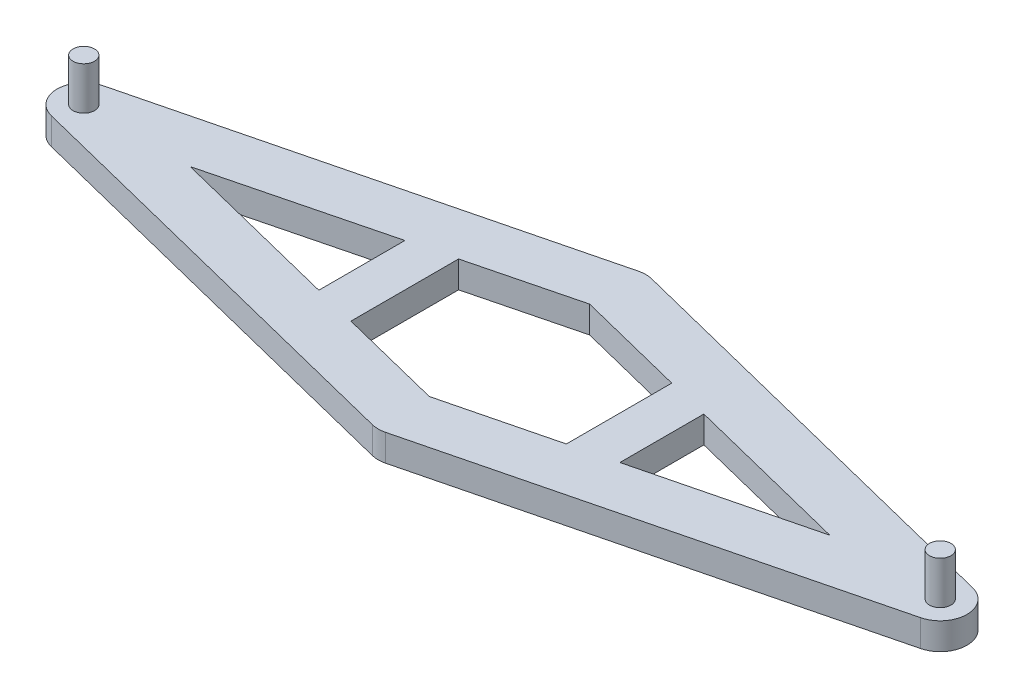
from build123d import *

# Parameters (mm, degrees)
BOSS_EXTRUDE1_DEPTH = 3.175
SKETCH5_R           = 1.27
BOSS_EXTRUDE2_DEPTH = 5.08
SKETCH6_R           = 1.27
BOSS_EXTRUDE3_DEPTH = 5.08
SKETCH10_W          = 5.08
SKETCH10_H          = 16.51
BOSS_EXTRUDE6_DEPTH = 3.175


with BuildPart() as part:
    # Sketch2 → Boss-Extrude1 (new body)
    with BuildSketch(Plane(origin=(0, 0, 0), x_dir=(1, 0, 0), z_dir=(0, 1, 0))):
        with BuildLine():
            Line((-51.57005061, 3.080202438), (-0.770050609, 15.780202438))
            ThreePointArc((-0.770050609, 15.780202438), (0, 15.875), (0.770050609, 15.780202438))
            Line((0.770050609, 15.780202438), (51.57005061, 3.080202438))
            ThreePointArc((51.57005061, 3.080202438), (53.975, 0), (51.57005061, -3.080202438))
            Line((51.57005061, -3.080202438), (0.770050609, -15.780202438))
            ThreePointArc((0.770050609, -15.780202438), (0, -15.875), (-0.770050609, -15.780202438))
            Line((-0.770050609, -15.780202438), (-51.57005061, -3.080202438))
            ThreePointArc((-51.57005061, -3.080202438), (-53.975, 0), (-51.57005061, 3.080202438))
        make_face()
        Polygon((37.709139639, 0), (-0.307385689, -9.504131332), (-38.111149392, -0.065221488), (-0.294525174, 9.500916203), align=None, mode=Mode.SUBTRACT)
    extrude(amount=BOSS_EXTRUDE1_DEPTH)

    # Sketch5 → Boss-Extrude2 (add)
    with BuildSketch(Plane(origin=(0, 3.175, 0), x_dir=(1, 0, 0), z_dir=(0, 1, 0))):
        with Locations(Location((-50.8, 0, 0), (0, 0, 270))):
            Circle(SKETCH5_R)
    extrude(amount=BOSS_EXTRUDE2_DEPTH)

    # Sketch6 → Boss-Extrude3 (add)
    with BuildSketch(Plane(origin=(0, 3.175, 0), x_dir=(1, 0, 0), z_dir=(0, 1, 0))):
        with Locations(Location((50.8, 0, 0), (0, 0, 270))):
            Circle(SKETCH6_R)
    extrude(amount=BOSS_EXTRUDE3_DEPTH)

    # Sketch10 → Boss-Extrude6 (add)
    with BuildSketch(Plane(origin=(0, 3.175, 0), x_dir=(1, 0, 0), z_dir=(0, 1, 0))):
        with Locations((-15.24, 0)):
            Rectangle(SKETCH10_W, SKETCH10_H)
        with Locations((15.24, 0)):
            Rectangle(SKETCH10_W, SKETCH10_H)
    extrude(amount=-BOSS_EXTRUDE6_DEPTH)


solid = part.part
